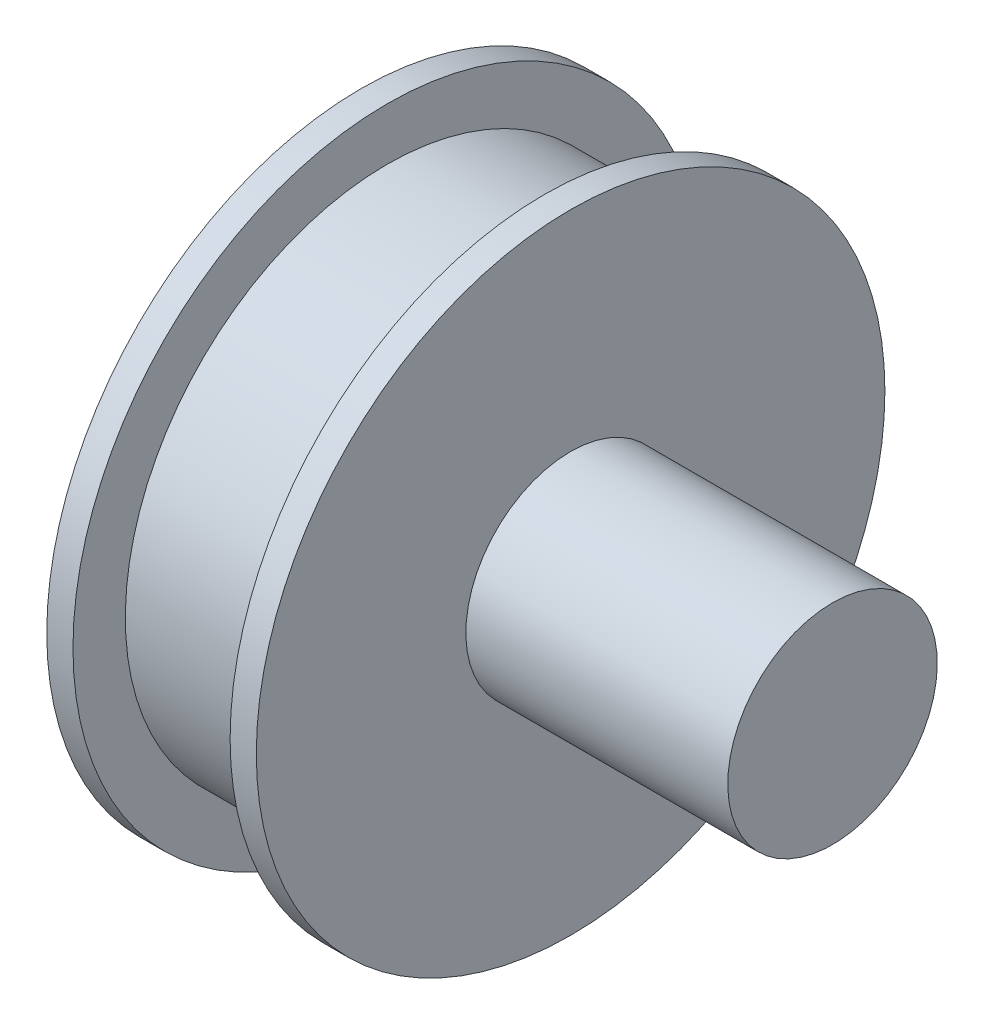
from build123d import *

# Parameters (mm, degrees)
CUT_EXTRUDE1_START = -5
SKETCH2_R          = 22.5
SKETCH2_R_2        = 10
CUT_EXTRUDE1_DEPTH = 5
FILLET1_R          = 1


with BuildPart() as part:
    # Sketch1 → Revolve1 (revolve)
    with BuildSketch(Plane.XY):
        Polygon((0, 5), (0, 30), (2.5, 30), (2.5, 25), (17.5, 25), (17.5, 30), (20, 30), (20, 10), (45, 10), (45, 0), (5, 0), (5, 5), align=None)
    revolve(axis=Axis((45, 0, 0), (-1, 0, 0)))

    # Sketch2 → Cut-Extrude1 (cut)
    with BuildSketch(Plane.ZY.offset(CUT_EXTRUDE1_START)):
        with Locations(Location((0, 0, 0), (0, 0, 270))):
            Circle(SKETCH2_R)
        with Locations(Location((0, 0, 0), (0, 0, 90))):
            Circle(SKETCH2_R_2, mode=Mode.SUBTRACT)
    extrude(amount=CUT_EXTRUDE1_DEPTH, mode=Mode.SUBTRACT)

    # Fillet1
    fillet1_edges = [part.edges().sort_by_distance(p)[0] for p in [
        (0, -10, 0),
    ]]
    fillet(fillet1_edges, radius=FILLET1_R)


solid = part.part
